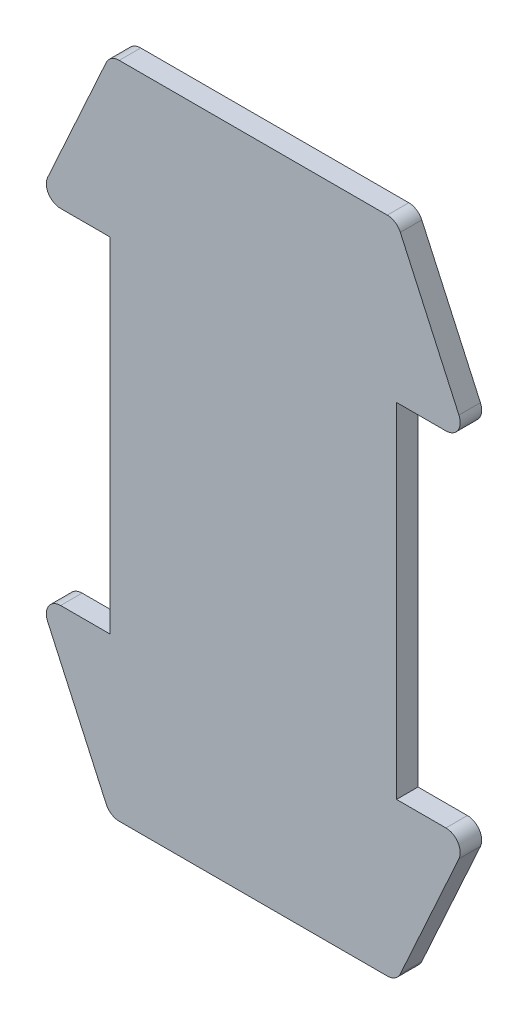
from build123d import *

# Parameters (mm, degrees)
BOSS_EXTRUDE1_DEPTH = 7.5
FILLET1_R           = 5


with BuildPart() as part:
    # Sketch1 → Boss-Extrude1 (new body)
    with BuildSketch(Plane.XY):
        Polygon((50, 115), (-50, 115), (-75, 60), (-50, 60), (-50, -60), (-75, -60), (-50, -115), (50, -115), (75, -60), (50, -60), (50, 60), (75, 60), align=None)
    extrude(amount=-BOSS_EXTRUDE1_DEPTH)

    # Fillet1
    fillet1_edges = [part.edges().sort_by_distance(p)[0] for p in [
        (-50, 115, -3.75),
        (50, 115, -3.75),
        (75, 60, -3.75),
        (75, -60, -3.75),
        (50, -115, -3.75),
        (-50, -115, -3.75),
        (-75, -60, -3.75),
        (-75, 60, -3.75),
    ]]
    fillet(fillet1_edges, radius=FILLET1_R)


solid = part.part
